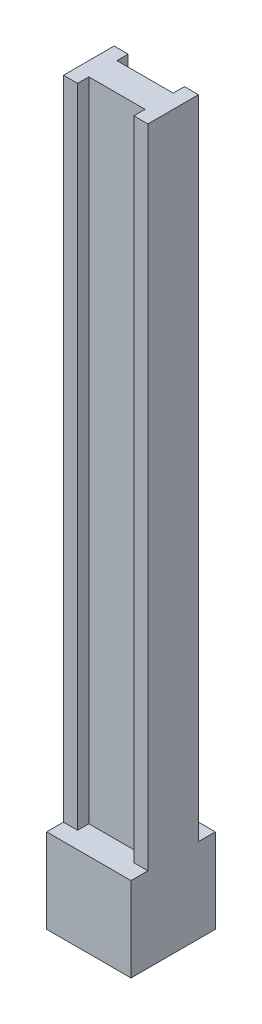
from build123d import *

# Parameters (mm, degrees)
SKETCH2_W           = 150
SKETCH2_H           = 150
BOSS_EXTRUDE1_DEPTH = 1300
SKETCH3_W           = 100
SKETCH3_H           = 50
CUT_EXTRUDE3_DEPTH  = 1150
SKETCH4_W           = 150
SKETCH4_H           = 30
CUT_EXTRUDE4_DEPTH  = 1150


with BuildPart() as part:
    # Sketch2 → Boss-Extrude1 (new body)
    with BuildSketch(Plane(origin=(0, 0, 0), x_dir=(1, 0, 0), z_dir=(0, 1, 0))):
        Rectangle(SKETCH2_W, SKETCH2_H)
    extrude(amount=BOSS_EXTRUDE1_DEPTH)

    # Sketch3 → Cut-Extrude3 (cut)
    with BuildSketch(Plane(origin=(0, 1300, 0), x_dir=(-1, 0, 0), z_dir=(0, 1, 0))):
        with Locations((0, -50)):
            Rectangle(SKETCH3_W, SKETCH3_H)
        with Locations((0, 50)):
            Rectangle(SKETCH3_W, SKETCH3_H)
    extrude(amount=-CUT_EXTRUDE3_DEPTH, mode=Mode.SUBTRACT)

    # Sketch4 → Cut-Extrude4 (cut)
    with BuildSketch(Plane(origin=(0, 1300, 0), x_dir=(-1, 0, 0), z_dir=(0, 1, 0))):
        with Locations((0, -60)):
            Rectangle(SKETCH4_W, SKETCH4_H)
        with Locations((0, 60)):
            Rectangle(SKETCH4_W, SKETCH4_H)
    extrude(amount=-CUT_EXTRUDE4_DEPTH, mode=Mode.SUBTRACT)


solid = part.part
